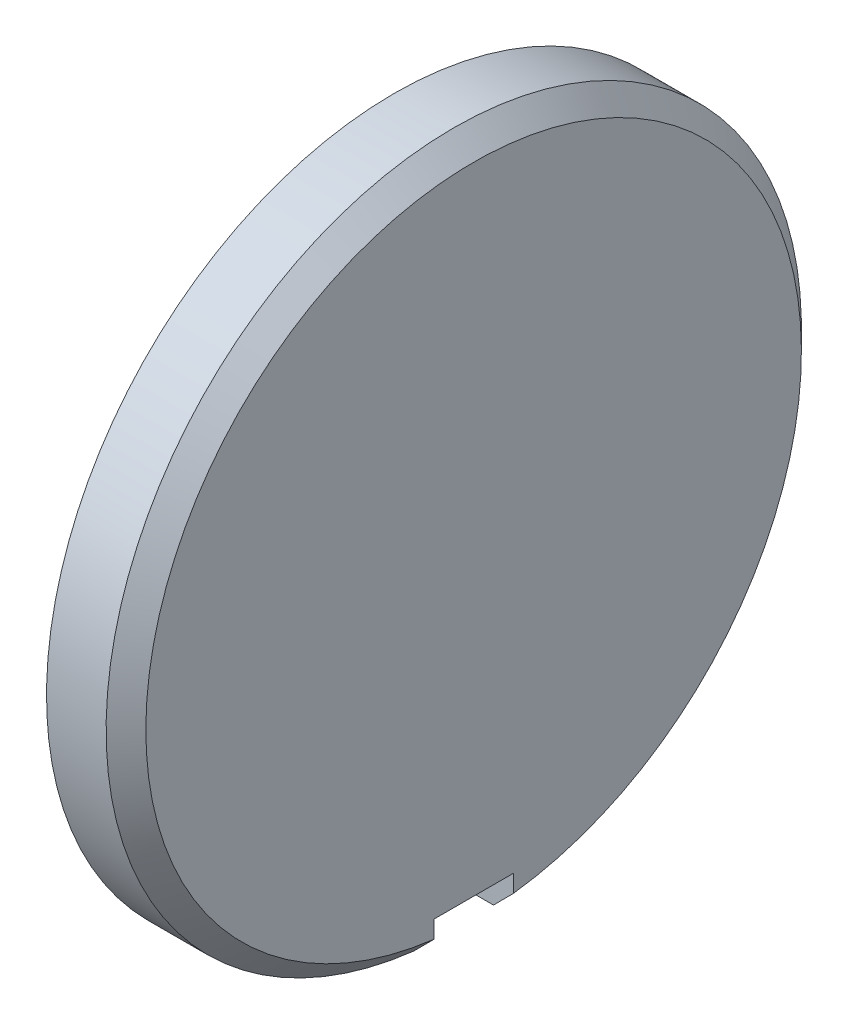
from build123d import *

# Parameters (mm, degrees)
BOSS_EXTRUDE1_START = -55.2
SKETCH2_W           = 1.28
SKETCH2_H           = 0.8
BOSS_EXTRUDE1_DEPTH = 6.4
BOSS_EXTRUDE2_START = -52.4
SKETCH3_W           = 1.28
SKETCH3_H           = 6.4
BOSS_EXTRUDE2_DEPTH = 0.8
BOSS_EXTRUDE3_START = -52.8
SKETCH4_W           = 1.8
SKETCH4_H           = 0.9
BOSS_EXTRUDE3_DEPTH = 1.6


with BuildPart() as part:
    # Sketch1 → Revolve1 (revolve)
    with BuildSketch(Plane.XY.offset(-52), mode=Mode.PRIVATE) as revolve1_sk:
        Polygon((82.8, -62.7), (84, -62.7), (84, -65), (85.6, -65), (85.6, -58.4), (85.2, -58), (84, -58), (84, -62), (82.8, -62), align=None)
    revolve(revolve1_sk.sketch.rotate(Axis((77.8, -65, -52), (1, 0, 0)), 90), axis=Axis((77.8, -65, -52), (1, 0, 0)))


with BuildPart() as body_2:
    # Sketch2 → Boss-Extrude1 (new body)
    with BuildSketch(Plane.XY.offset(BOSS_EXTRUDE1_START)):
        with Locations((83.34, -65)):
            Rectangle(SKETCH2_W, SKETCH2_H)
    extrude(amount=BOSS_EXTRUDE1_DEPTH)


with BuildPart() as part_1:
    add(part.part)

    # Combine1: cut body 2
    add(body_2.part, mode=Mode.SUBTRACT)


with BuildPart() as body_2_2:
    # Sketch3 → Boss-Extrude2 (new body)
    with BuildSketch(Plane.XY.offset(BOSS_EXTRUDE2_START)):
        with Locations((83.34, -65)):
            Rectangle(SKETCH3_W, SKETCH3_H)
    extrude(amount=BOSS_EXTRUDE2_DEPTH)


with BuildPart() as part_2:
    add(part_1.part)

    # Combine2: cut body 2 2
    add(body_2_2.part, mode=Mode.SUBTRACT)


with BuildPart() as body_2_3:
    # Sketch4 → Boss-Extrude3 (new body)
    with BuildSketch(Plane.XY.offset(BOSS_EXTRUDE3_START)):
        with Locations((84.8, -71.65)):
            Rectangle(SKETCH4_W, SKETCH4_H)
    extrude(amount=BOSS_EXTRUDE3_DEPTH)


with BuildPart() as part_3:
    add(part_2.part)

    # Combine3: cut body 2 3
    add(body_2_3.part, mode=Mode.SUBTRACT)


solid = part_3.part
